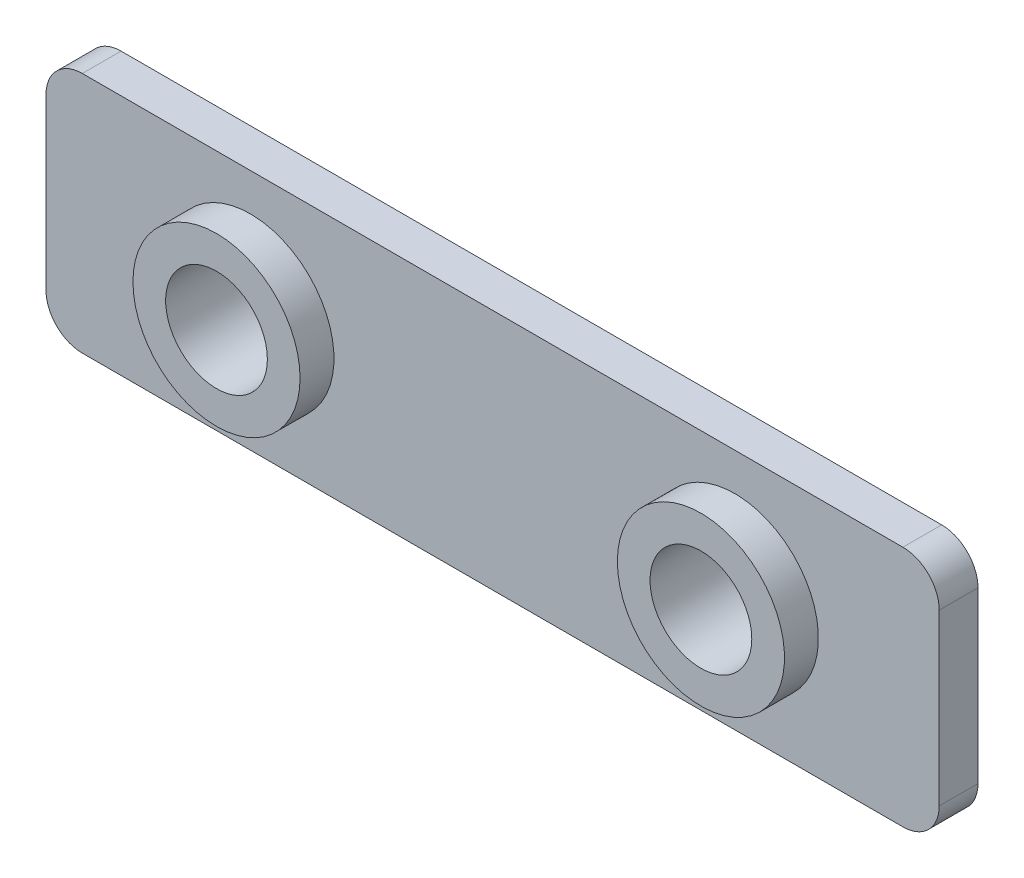
from build123d import *

# Parameters (mm, degrees)
BOSS_EXTRUDE1_DEPTH   = 1.6
SKETCH2_R             = 3.45
BOSS_EXTRUDE2_DEPTH   = 1.4
M5X0_8_TAPPED_HOLE1_D = 4.2


with BuildPart() as part:
    # Sketch1 → Boss-Extrude1 (new body)
    with BuildSketch(Plane.XY):
        with BuildLine():
            Line((1.5, 0), (35.38, 0))
            ThreePointArc((35.38, 0), (36.440660172, 0.439339828), (36.88, 1.5))
            Line((36.88, 1.5), (36.88, 8.5))
            ThreePointArc((36.88, 8.5), (36.440660172, 9.560660172), (35.38, 10))
            Line((35.38, 10), (1.5, 10))
            ThreePointArc((1.5, 10), (0.439339828, 9.560660172), (0, 8.5))
            Line((0, 8.5), (0, 1.5))
            ThreePointArc((0, 1.5), (0.439339828, 0.439339828), (1.5, 0))
        make_face()
    extrude(amount=BOSS_EXTRUDE1_DEPTH)

    # Sketch2 → Boss-Extrude2 (add)
    with BuildSketch(Plane.XY.offset(1.6)):
        with Locations(Location((8.44, 5, 0), (0, 0, 180))):
            Circle(SKETCH2_R)
        with Locations(Location((28.44, 5, 0), (0, 0, 180))):
            Circle(SKETCH2_R)
    extrude(amount=BOSS_EXTRUDE2_DEPTH)

    # M5x0.8 Tapped Hole1 (through all)
    with Locations(Plane.XY.offset(3)):
        with Locations((8.44, 5), (28.44, 5)):
            Hole(M5X0_8_TAPPED_HOLE1_D / 2)


solid = part.part
